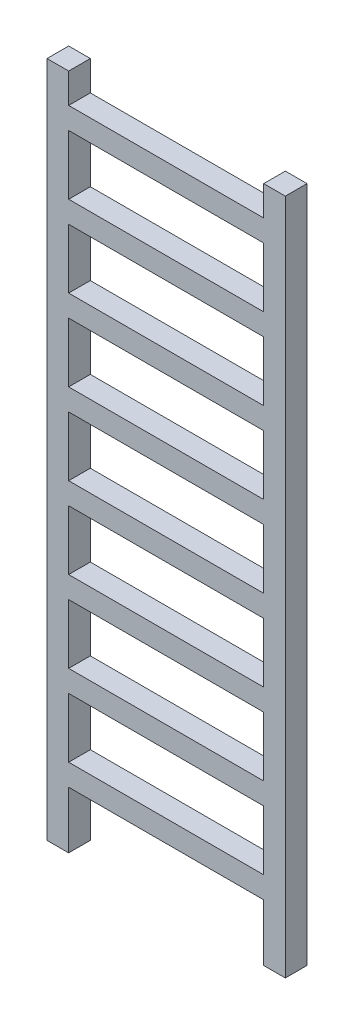
from build123d import *

# Parameters (mm, degrees)
SKETCH_1_W       = 80
SKETCH_1_H       = 2500
EXTRUDE_1_DEPTH  = 80
SKETCH_2_W       = 80
SKETCH_2_H       = 2500
EXTRUDE_2_DEPTH  = 80
SKETCH_3_W       = 800
SKETCH_3_H       = 80
EXTRUDE_3_DEPTH  = 80
SKETCH_4_W       = 800
SKETCH_4_H       = 80
EXTRUDE_4_DEPTH  = 80
SKETCH_5_W       = 800
SKETCH_5_H       = 80
EXTRUDE_5_DEPTH  = 80
SKETCH_6_W       = 800
SKETCH_6_H       = 80
EXTRUDE_6_DEPTH  = 80
SKETCH_7_W       = 800
SKETCH_7_H       = 80
EXTRUDE_7_DEPTH  = 80
SKETCH_8_W       = 800
SKETCH_8_H       = 80
EXTRUDE_8_DEPTH  = 80
SKETCH_9_W       = 800
SKETCH_9_H       = 80
EXTRUDE_9_DEPTH  = 80
SKETCH_10_W      = 800
SKETCH_10_H      = 80
EXTRUDE_10_DEPTH = 80


with BuildPart() as part:
    # 草图1 → 凸台-拉伸1 (new body)
    with BuildSketch(Plane.XY):
        with Locations((-400, 0)):
            Rectangle(SKETCH_1_W, SKETCH_1_H)
    extrude(amount=EXTRUDE_1_DEPTH)



with BuildPart() as body_2:
    # 草图2 → 凸台-拉伸2 (new body)
    with BuildSketch(Plane.XY):
        with Locations((400, 0)):
            Rectangle(SKETCH_2_W, SKETCH_2_H)
    extrude(amount=EXTRUDE_2_DEPTH)


with BuildPart() as part_1:
    add(part.part)

    add(body_2.part)  # 凸台-拉伸3 merges body 2
    # 草图3 → 凸台-拉伸3 (add)
    with BuildSketch(Plane.XY):
        with Locations((0, 1100)):
            Rectangle(SKETCH_3_W, SKETCH_3_H)
    extrude(amount=EXTRUDE_3_DEPTH)

    # 草图4 → 凸台-拉伸4 (add)
    with BuildSketch(Plane.XY):
        with Locations((0, 800)):
            Rectangle(SKETCH_4_W, SKETCH_4_H)
    extrude(amount=EXTRUDE_4_DEPTH)

    # 草图5 → 凸台-拉伸5 (add)
    with BuildSketch(Plane.XY):
        with Locations((0, 500)):
            Rectangle(SKETCH_5_W, SKETCH_5_H)
    extrude(amount=EXTRUDE_5_DEPTH)

    # 草图6 → 凸台-拉伸6 (add)
    with BuildSketch(Plane.XY):
        with Locations((0, 200)):
            Rectangle(SKETCH_6_W, SKETCH_6_H)
    extrude(amount=EXTRUDE_6_DEPTH)

    # 草图7 → 凸台-拉伸7 (add)
    with BuildSketch(Plane.XY):
        with Locations((0, -100)):
            Rectangle(SKETCH_7_W, SKETCH_7_H)
    extrude(amount=EXTRUDE_7_DEPTH)

    # 草图8 → 凸台-拉伸8 (add)
    with BuildSketch(Plane.XY):
        with Locations((0, -400)):
            Rectangle(SKETCH_8_W, SKETCH_8_H)
    extrude(amount=EXTRUDE_8_DEPTH)

    # 草图9 → 凸台-拉伸9 (add)
    with BuildSketch(Plane.XY):
        with Locations((0, -700)):
            Rectangle(SKETCH_9_W, SKETCH_9_H)
    extrude(amount=EXTRUDE_9_DEPTH)

    # 草图10 → 凸台-拉伸10 (add)
    with BuildSketch(Plane.XY):
        with Locations((0, -1000)):
            Rectangle(SKETCH_10_W, SKETCH_10_H)
    extrude(amount=EXTRUDE_10_DEPTH)


solid = part_1.part
